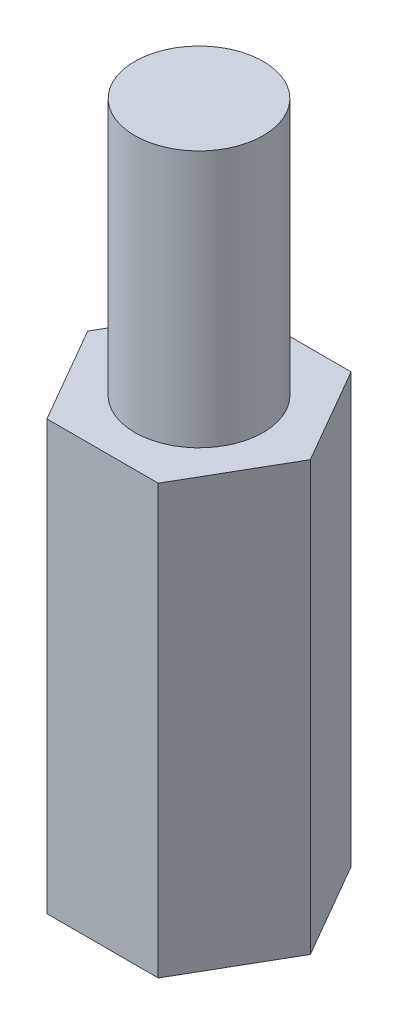
from build123d import *

# Parameters (mm, degrees)
SKETCH1_R           = 1.5
BOSS_EXTRUDE1_DEPTH = 10
BOSS_EXTRUDE2_DEPTH = 3
SKETCH3_R           = 1.5
BOSS_EXTRUDE3_DEPTH = 6


with BuildPart() as part:
    # Sketch1 → Boss-Extrude1 (new body)
    with BuildSketch(Plane(origin=(0, 0, 0), x_dir=(1, 0, 0), z_dir=(0, 1, 0))):
        Polygon((2.598076211, 0), (1.299038106, 2.25), (-1.299038106, 2.25), (-2.598076211, 0), (-1.299038106, -2.25), (1.299038106, -2.25), align=None)
        with Locations(Location((0, 0, 0), (0, 0, 270))):
            Circle(SKETCH1_R, mode=Mode.SUBTRACT)
    extrude(amount=BOSS_EXTRUDE1_DEPTH)

    # Sketch2 → Boss-Extrude2 (add)
    with BuildSketch(Plane(origin=(0, 10, 0), x_dir=(1, 0, 0), z_dir=(0, 1, 0))):
        Polygon((2.598076211, 0), (1.299038106, 2.25), (-1.299038106, 2.25), (-2.598076211, 0), (-1.299038106, -2.25), (1.299038106, -2.25), align=None)
    extrude(amount=-BOSS_EXTRUDE2_DEPTH)

    # Sketch3 → Boss-Extrude3 (add)
    with BuildSketch(Plane(origin=(0, 10, 0), x_dir=(1, 0, 0), z_dir=(0, 1, 0))):
        with Locations(Location((0, 0, 0), (0, 0, 270))):
            Circle(SKETCH3_R)
    extrude(amount=BOSS_EXTRUDE3_DEPTH)


solid = part.part
